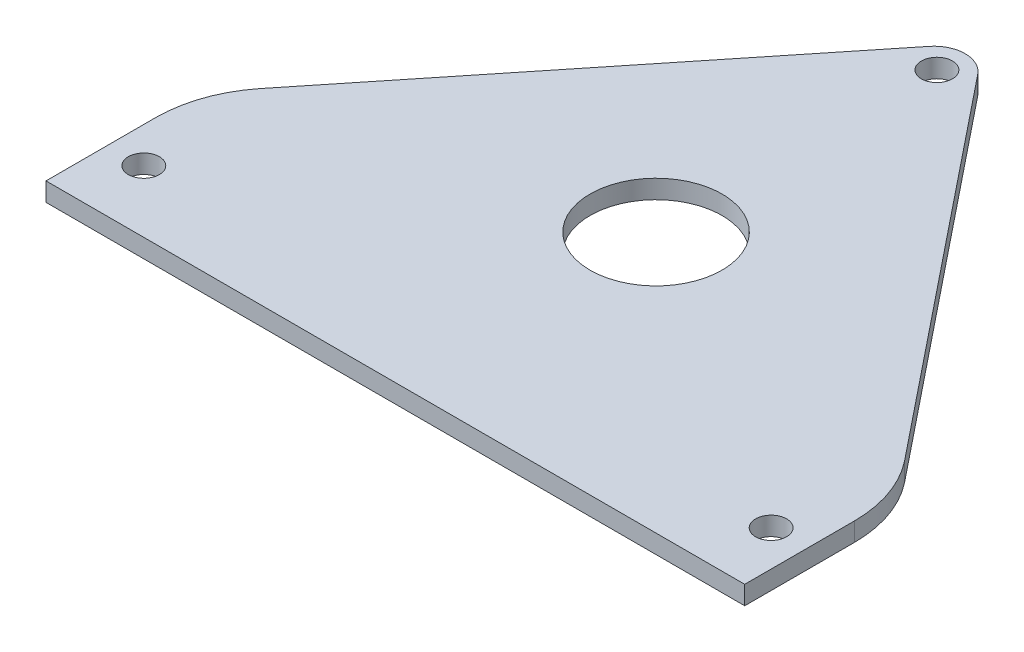
from build123d import *

# Parameters (mm, degrees)
SKETCH_1_W          = 45
SKETCH_1_H          = 8
SKETCH_1_R          = 1
EXTRUDE_1_DEPTH     = 1.2
SKETCH_2_W          = 45
SKETCH_2_H          = 30.15
SKETCH_2_R          = 1
SKETCH_2_R_2        = 4.25
EXTRUDE_2_DEPTH     = 1.2
CUT_EXTRUDE_1_DEPTH = 60.007308869
FILLET_2_R          = 8
FILLET_3_R          = 2
EXTRUDE_START       = -1.2
SKETCH_7_R          = 1
SKETCH_7_W          = 45
SKETCH_7_H          = 0.26
EXTRUDE_3_DEPTH     = 1.2
SKETCH_8_W          = 45
SKETCH_8_H          = 0.26
CUT_EXTRUDE_2_DEPTH = 59.24231093
SKETCH_9_R          = 1
CUT_EXTRUDE_3_DEPTH = 59.24231093
SKETCH_10_R         = 4.25
SKETCH_10_R_2       = 1
EXTRUDE_4_DEPTH     = 1.2
SKETCH_11_R         = 4.25
SKETCH_11_R_2       = 1
CUT_EXTRUDE_4_DEPTH = 59.24231093


with BuildPart() as part:
    # ｽｹｯﾁ1 → ﾎﾞｽ - 押し出し1 (new body)
    with BuildSketch(Plane(origin=(0, 0, 0), x_dir=(1, 0, 0), z_dir=(0, 1, 0))):
        with Locations((22.5, 4)):
            Rectangle(SKETCH_1_W, SKETCH_1_H)
        with Locations(Location((2, 3.78, 0), (0, 0, 270))):
            Circle(SKETCH_1_R, mode=Mode.SUBTRACT)
        with Locations(Location((43, 3.78, 0), (0, 0, 90))):
            Circle(SKETCH_1_R, mode=Mode.SUBTRACT)
    extrude(amount=EXTRUDE_1_DEPTH)

    # ｽｹｯﾁ2 → ﾎﾞｽ - 押し出し2 (add)
    with BuildSketch(Plane(origin=(0, 1.2, 0), x_dir=(1, 0, 0), z_dir=(0, 1, 0))):
        with Locations((22.5, 23.075)):
            Rectangle(SKETCH_2_W, SKETCH_2_H)
        with Locations(Location((22.5, 35.15, 0), (0, 0, 270))):
            Circle(SKETCH_2_R, mode=Mode.SUBTRACT)
        with Locations(Location((22.5, 17.1, 0), (0, 0, 270))):
            Circle(SKETCH_2_R_2, mode=Mode.SUBTRACT)
    extrude(amount=-EXTRUDE_2_DEPTH)

    # ｽｹｯﾁ6 → ｶｯﾄ - 押し出し1 (cut, through all)
    with BuildSketch(Plane(origin=(0, 1.2, 0), x_dir=(1, 0, 0), z_dir=(0, 1, 0))):
        Polygon((0, 38.15), (0, 10.130291319), (22.5, 38.15), align=None)
        Polygon((45, 38.15), (22.5, 38.15), (45, 10.130291319), align=None)
    extrude(amount=-CUT_EXTRUDE_1_DEPTH, mode=Mode.SUBTRACT)

    # ﾌｨﾚｯﾄ2
    fillet_2_edges = [part.edges().sort_by_distance(p)[0] for p in [
        (45, 0.6, -10.130291319),
        (0, 0.6, -10.130291319),
    ]]
    fillet(fillet_2_edges, radius=FILLET_2_R)

    # ﾌｨﾚｯﾄ3
    fillet_3_edges = [part.edges().sort_by_distance(p)[0] for p in [
        (22.5, 0.6, -38.15),
    ]]
    fillet(fillet_3_edges, radius=FILLET_3_R)

    # ｽｹｯﾁ7 → ﾎﾞｽ - 押し出し3 (add)
    with BuildSketch(Plane(origin=(0, 1.2, 0), x_dir=(1, 0, 0), z_dir=(0, 1, 0)).offset(EXTRUDE_START)):
        with Locations((2, 3.78)):
            Circle(SKETCH_7_R)
        with Locations((43, 3.78)):
            Circle(SKETCH_7_R)
        with Locations((22.5, 0.13)):
            Rectangle(SKETCH_7_W, SKETCH_7_H)
    extrude(amount=EXTRUDE_3_DEPTH)

    # ｽｹｯﾁ8 → ｶｯﾄ - 押し出し2 (cut, through all)
    with BuildSketch(Plane(origin=(0, 1.2, 0), x_dir=(1, 0, 0), z_dir=(0, 1, 0))):
        with Locations((22.5, 0.13)):
            Rectangle(SKETCH_8_W, SKETCH_8_H)
    extrude(amount=-CUT_EXTRUDE_2_DEPTH, mode=Mode.SUBTRACT)

    # ｽｹｯﾁ9 → ｶｯﾄ - 押し出し3 (cut, through all)
    with BuildSketch(Plane(origin=(0, 1.2, 0), x_dir=(1, 0, 0), z_dir=(0, 1, 0))):
        with Locations(Location((2.3, 4.26, 0), (0, 0, 270))):
            Circle(SKETCH_9_R)
        with Locations(Location((42.7, 4.26, 0), (0, 0, 90))):
            Circle(SKETCH_9_R)
    extrude(amount=-CUT_EXTRUDE_3_DEPTH, mode=Mode.SUBTRACT)

    # ｽｹｯﾁ10 → ﾎﾞｽ - 押し出し4 (add)
    with BuildSketch(Plane(origin=(0, 1.2, 0), x_dir=(1, 0, 0), z_dir=(0, 1, 0))):
        with Locations((22.5, 17.1)):
            Circle(SKETCH_10_R)
        with Locations((22.5, 35.15)):
            Circle(SKETCH_10_R_2)
    extrude(amount=-EXTRUDE_4_DEPTH)

    # ｽｹｯﾁ11 → ｶｯﾄ - 押し出し4 (cut, through all)
    with BuildSketch(Plane(origin=(0, 1.2, 0), x_dir=(1, 0, 0), z_dir=(0, 1, 0))):
        with Locations(Location((22.5, 17.05, 0), (0, 0, 270))):
            Circle(SKETCH_11_R)
        with Locations(Location((22.5, 35.14, 0), (0, 0, 270))):
            Circle(SKETCH_11_R_2)
    extrude(amount=-CUT_EXTRUDE_4_DEPTH, mode=Mode.SUBTRACT)


solid = part.part
